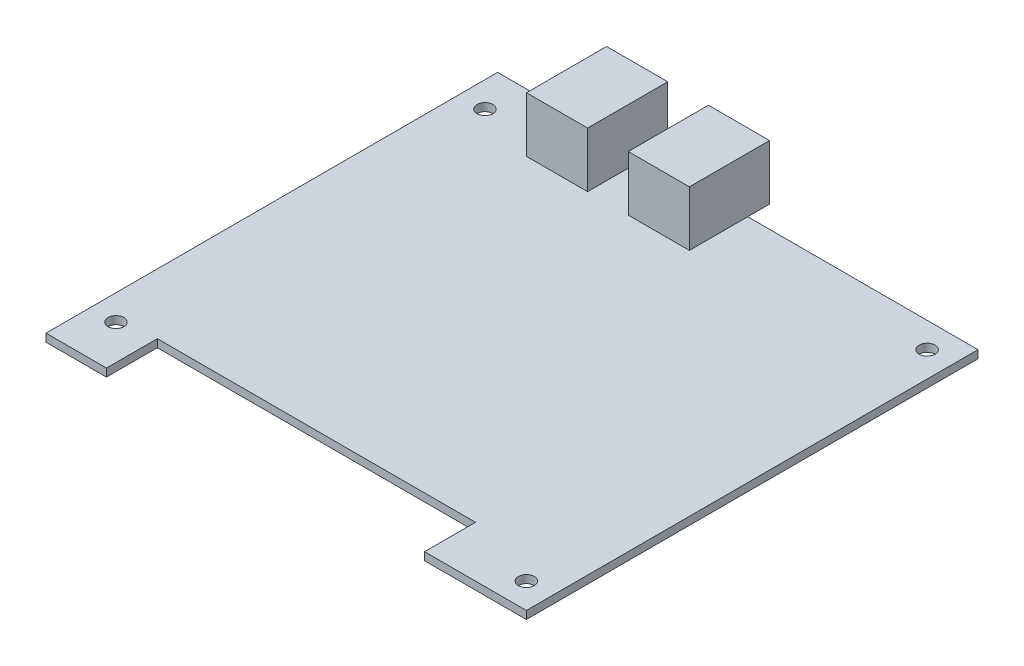
from build123d import *

# Parameters (mm, degrees)
BOSS_EXTRUDE1_DEPTH   = 1.57
SKETCH2_R             = 1.59
CUT_EXTRUDE1_DEPTH    = 66.831946272
SKETCH3_W             = 12.2
SKETCH3_H             = 16
BOSS_EXTRUDE2_DEPTH   = 11
BOSS_EXTRUDE2_2_DEPTH = 11


with BuildPart() as part:
    # Sketch1 → Boss-Extrude1 (new body)
    with BuildSketch(Plane(origin=(0, 0, 0), x_dir=(1, 0, 0), z_dir=(0, 1, 0))):
        Polygon((-35.875, -45.085), (-47.945, -45.085), (-47.945, 45.085), (47.945, 45.085), (47.945, -45.085), (27.625, -45.085), (27.625, -34.925), (-35.875, -34.925), align=None)
    extrude(amount=BOSS_EXTRUDE1_DEPTH)

    # Sketch2 → Cut-Extrude1 (cut, through all)
    with BuildSketch(Plane(origin=(0, 1.57, 0), x_dir=(1, 0, 0), z_dir=(0, 1, 0))):
        with Locations(Location((42.865, -40.005, 0), (0, 0, 270))):
            Circle(SKETCH2_R)
        with Locations(Location((-42.865, -36.195, 0), (0, 0, 270))):
            Circle(SKETCH2_R)
        with Locations(Location((-42.865, 37.465, 0), (0, 0, 270))):
            Circle(SKETCH2_R)
        with Locations(Location((42.865, 40.005, 0), (0, 0, 270))):
            Circle(SKETCH2_R)
    extrude(amount=-CUT_EXTRUDE1_DEPTH, mode=Mode.SUBTRACT)


with BuildPart() as body_2:
    # Sketch3 → Boss-Extrude2 (new body)
    with BuildSketch(Plane(origin=(0, 1.57, 0), x_dir=(1, 0, 0), z_dir=(0, 1, 0))):
        with Locations((-24.445, 41.435)):
            Rectangle(SKETCH3_W, SKETCH3_H)
    extrude(amount=BOSS_EXTRUDE2_DEPTH)


with BuildPart() as body_3:
    # Sketch3 → Boss-Extrude2 2 (new body)
    with BuildSketch(Plane(origin=(0, 1.57, 0), x_dir=(1, 0, 0), z_dir=(0, 1, 0))):
        with Locations((-4.125, 41.435)):
            Rectangle(SKETCH3_W, SKETCH3_H)
    extrude(amount=BOSS_EXTRUDE2_2_DEPTH)


solid = Compound([part.part, body_2.part, body_3.part])
